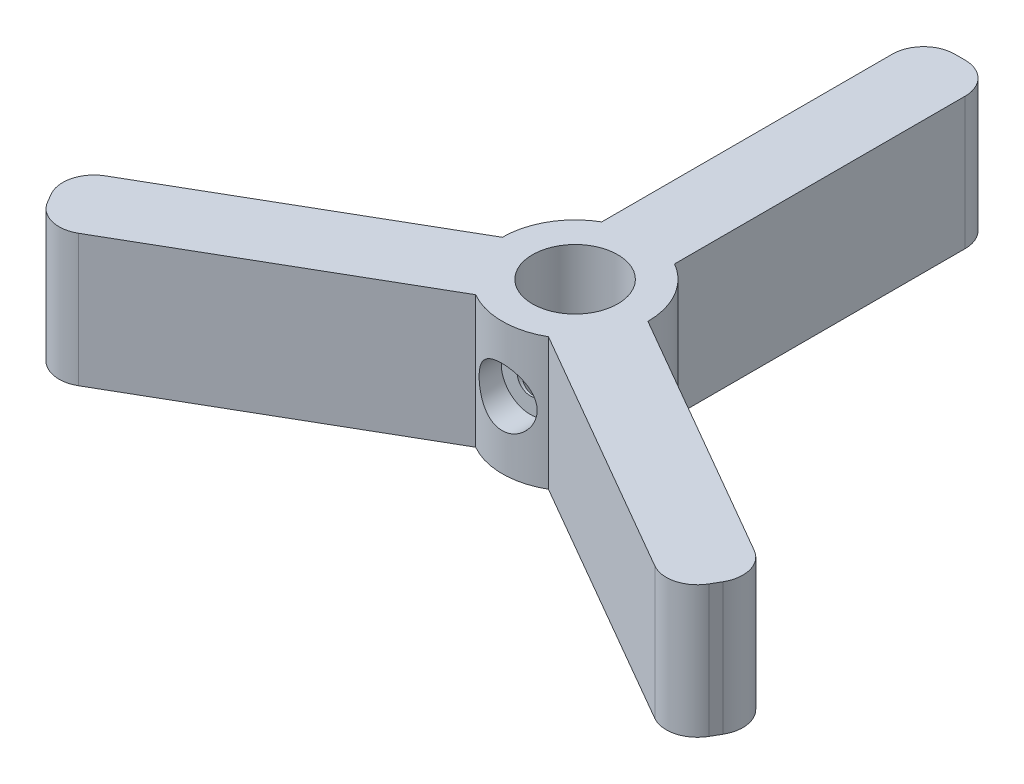
from build123d import *

# Parameters (mm, degrees)
BOSS_EXTRUDE1_DEPTH                               = 12.7
SKETCH2_R                                         = 4.1
CUT_EXTRUDE1_DEPTH                                = 51.982782527
CBORE_FOR_M5_HEX_HEAD_BOLT1_D                     = 2.5
CBORE_FOR_M5_HEX_HEAD_BOLT1_DEPTH                 = 18
CBORE_FOR_M5_HEX_HEAD_BOLT1_CBORE_D               = 5.6
CBORE_FOR_M5_HEX_HEAD_BOLT1_CBORE_DEPTH           = 2.7
CBORE_FOR_M5_HEX_HEAD_BOLT1_TIP                   = 0.751075774
CBORE_FOR_M5_HEX_HEAD_BOLT1_ON_FACE_2_D           = 2.5
CBORE_FOR_M5_HEX_HEAD_BOLT1_ON_FACE_2_DEPTH       = 18
CBORE_FOR_M5_HEX_HEAD_BOLT1_ON_FACE_2_CBORE_D     = 5.6
CBORE_FOR_M5_HEX_HEAD_BOLT1_ON_FACE_2_CBORE_DEPTH = 2.7
CBORE_FOR_M5_HEX_HEAD_BOLT1_ON_FACE_2_TIP         = 0.751075774


with BuildPart() as part:
    # Sketch1 → Boss-Extrude1 (new body)
    with BuildSketch(Plane(origin=(0, 0, 0), x_dir=(1, 0, 0), z_dir=(0, 1, 0))):
        with BuildLine():
            Line((-0.5, 37), (0.5, 37))
            ThreePointArc((0.5, 37), (2.621320344, 36.121320344), (3.5, 34))
            Line((3.5, 34), (3.5, 6.062177826))
            ThreePointArc((3.5, 6.062177826), (6.062177826, 3.5), (7, 0))
            Line((7, 0), (31.194863729, -13.968911087))
            ThreePointArc((31.194863729, -13.968911087), (32.592641208, -15.790530163), (32.29293994, -18.066987298))
            Line((32.29293994, -18.066987298), (31.79293994, -18.933012702))
            ThreePointArc((31.79293994, -18.933012702), (29.971320864, -20.330790181), (27.694863729, -20.031088913))
            Line((27.694863729, -20.031088913), (3.5, -6.062177826))
            ThreePointArc((3.5, -6.062177826), (0, -7), (-3.5, -6.062177826))
            Line((-3.5, -6.062177826), (-27.694863729, -20.031088913))
            ThreePointArc((-27.694863729, -20.031088913), (-29.971320864, -20.330790181), (-31.79293994, -18.933012702))
            Line((-31.79293994, -18.933012702), (-32.29293994, -18.066987298))
            ThreePointArc((-32.29293994, -18.066987298), (-32.592641208, -15.790530163), (-31.194863729, -13.968911087))
            Line((-31.194863729, -13.968911087), (-7, 0))
            ThreePointArc((-7, 0), (-6.062177826, 3.5), (-3.5, 6.062177826))
            Line((-3.5, 6.062177826), (-3.5, 34))
            ThreePointArc((-3.5, 34), (-2.621320344, 36.121320344), (-0.5, 37))
        make_face()
    extrude(amount=BOSS_EXTRUDE1_DEPTH)

    # Sketch2 → Cut-Extrude1 (cut, through all)
    with BuildSketch(Plane(origin=(0, 12.7, 0), x_dir=(1, 0, 0), z_dir=(0, 1, 0))):
        with Locations(Location((0, 0, 0), (0, 0, 270))):
            Circle(SKETCH2_R)
    extrude(amount=-CUT_EXTRUDE1_DEPTH, mode=Mode.SUBTRACT)

    # CBORE for M5 Hex Head Bolt1
    with Locations(Plane(origin=(-0.022879542, 6.389773721, 6.999962609), x_dir=(0.99999465842, 0, 0.003268506014), z_dir=(-0.003268506014, 0, 0.99999465842))):
        with Locations((0, 0)):
            CounterBoreHole(CBORE_FOR_M5_HEX_HEAD_BOLT1_D / 2, CBORE_FOR_M5_HEX_HEAD_BOLT1_CBORE_D / 2, CBORE_FOR_M5_HEX_HEAD_BOLT1_CBORE_DEPTH, depth=CBORE_FOR_M5_HEX_HEAD_BOLT1_DEPTH)
            with Locations((0, 0, -(CBORE_FOR_M5_HEX_HEAD_BOLT1_DEPTH + CBORE_FOR_M5_HEX_HEAD_BOLT1_TIP / 2))):  # 118° drill point
                Cone(0, CBORE_FOR_M5_HEX_HEAD_BOLT1_D / 2, CBORE_FOR_M5_HEX_HEAD_BOLT1_TIP, mode=Mode.SUBTRACT)

    # CBORE for M5 Hex Head Bolt1 on face 2
    with Locations(Plane(origin=(1.383929949, -4.684067914, 0), x_dir=(0.99999465842, 0, 0.003268506014), z_dir=(-0.003268506014, 0, 0.99999465842))):
        with Locations((0, 0)):
            CounterBoreHole(CBORE_FOR_M5_HEX_HEAD_BOLT1_ON_FACE_2_D / 2, CBORE_FOR_M5_HEX_HEAD_BOLT1_ON_FACE_2_CBORE_D / 2, CBORE_FOR_M5_HEX_HEAD_BOLT1_ON_FACE_2_CBORE_DEPTH, depth=CBORE_FOR_M5_HEX_HEAD_BOLT1_ON_FACE_2_DEPTH)
            with Locations((0, 0, -(CBORE_FOR_M5_HEX_HEAD_BOLT1_ON_FACE_2_DEPTH + CBORE_FOR_M5_HEX_HEAD_BOLT1_ON_FACE_2_TIP / 2))):  # 118° drill point
                Cone(0, CBORE_FOR_M5_HEX_HEAD_BOLT1_ON_FACE_2_D / 2, CBORE_FOR_M5_HEX_HEAD_BOLT1_ON_FACE_2_TIP, mode=Mode.SUBTRACT)


solid = part.part
